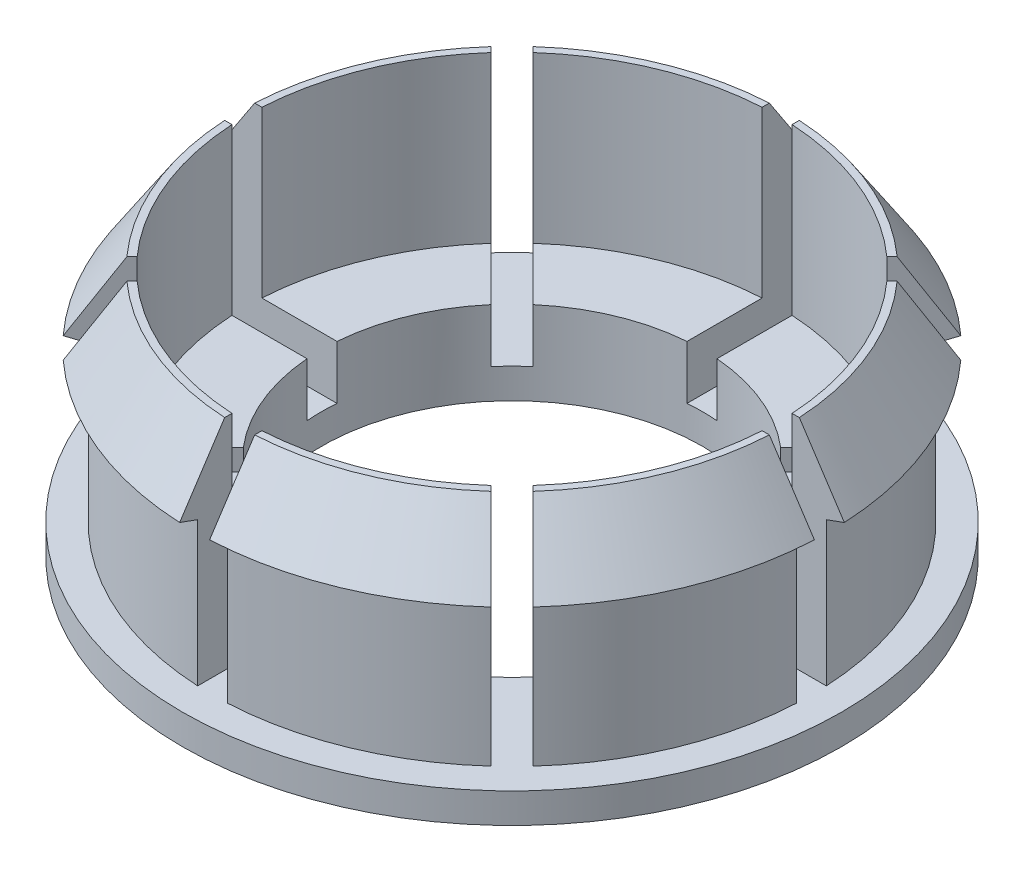
from build123d import *

# Parameters (mm, degrees)
CUT_EXTRUDE3_REACH             = 24.395
SKETCH6_W                      = 1.27
SKETCH6_H                      = 13.462
CUT_EXTRUDE3_DIRECTION_2_DEPTH = 23.394615982
CIRPATTERN1_COUNT              = 8


with BuildPart() as part:
    # Sketch5 → Revolve1 (revolve)
    with BuildSketch(Plane.XY, mode=Mode.PRIVATE) as revolve1_sk:
        Polygon((-11.249999979, -3.5), (-11.249999979, 3.5), (-11.557, 3.5), (-13.462, 0.602345319), (-12.7, 0.325), (-12.7, -5.775), (-13.97, -5.775), (-13.97, -7.045), (-8.074999979, -7.045), (-8.074999979, -3.5), align=None)
    revolve(revolve1_sk.sketch.rotate(Axis((0, 0.325, 0), (0, -1, 0)), 270), axis=Axis((0, 0.325, 0), (0, -1, 0)))

    # Cut-Extrude3: up to this face of the body (flat: up to its plane)
    cut_extrude3_end = Plane(part.part.faces().sort_by_distance((0, -5.775, -13.095131269))[0])
    # Sketch6 → Cut-Extrude3 (cut, up to the picked face)
    with BuildSketch(Plane(origin=(0, 3.5, 0), x_dir=(1, 0, 0), z_dir=(0, 1, 0)), mode=Mode.PRIVATE) as cut_extrude3_sk1:
        with Locations((0, 6.731)):
            Rectangle(SKETCH6_W, SKETCH6_H)
    cut_extrude3_tool1 = split(extrude(cut_extrude3_sk1.sketch, amount=-CUT_EXTRUDE3_REACH, mode=Mode.PRIVATE), bisect_by=cut_extrude3_end, keep=Keep.BOTH, mode=Mode.PRIVATE)
    cut_extrude3 = cut_extrude3_tool1.solids().sort_by(Axis((0, 3.5, -6.731), (0, -1, 0)))[0]
    add(cut_extrude3, mode=Mode.SUBTRACT)

    # Sketch6 → Cut-Extrude3 direction 2 (cut)
    with BuildSketch(Plane(origin=(0, 3.5, 0), x_dir=(1, 0, 0), z_dir=(0, 1, 0))):
        with Locations((0, 6.731)):
            Rectangle(SKETCH6_W, SKETCH6_H)
    cut_extrude3_direction_2 = extrude(amount=CUT_EXTRUDE3_DIRECTION_2_DEPTH, mode=Mode.SUBTRACT)

    # CirPattern1: Cut-Extrude3, Cut-Extrude3 direction 2 ×8 about axis
    cirpattern1_axis = Axis((0, 0, 0), (0, 1, 0))
    add([cut_extrude3.rotate(cirpattern1_axis, i * 360 / CIRPATTERN1_COUNT) for i in range(1, CIRPATTERN1_COUNT)], mode=Mode.SUBTRACT)
    add([cut_extrude3_direction_2.rotate(cirpattern1_axis, i * 360 / CIRPATTERN1_COUNT) for i in range(1, CIRPATTERN1_COUNT)], mode=Mode.SUBTRACT)


solid = part.part
